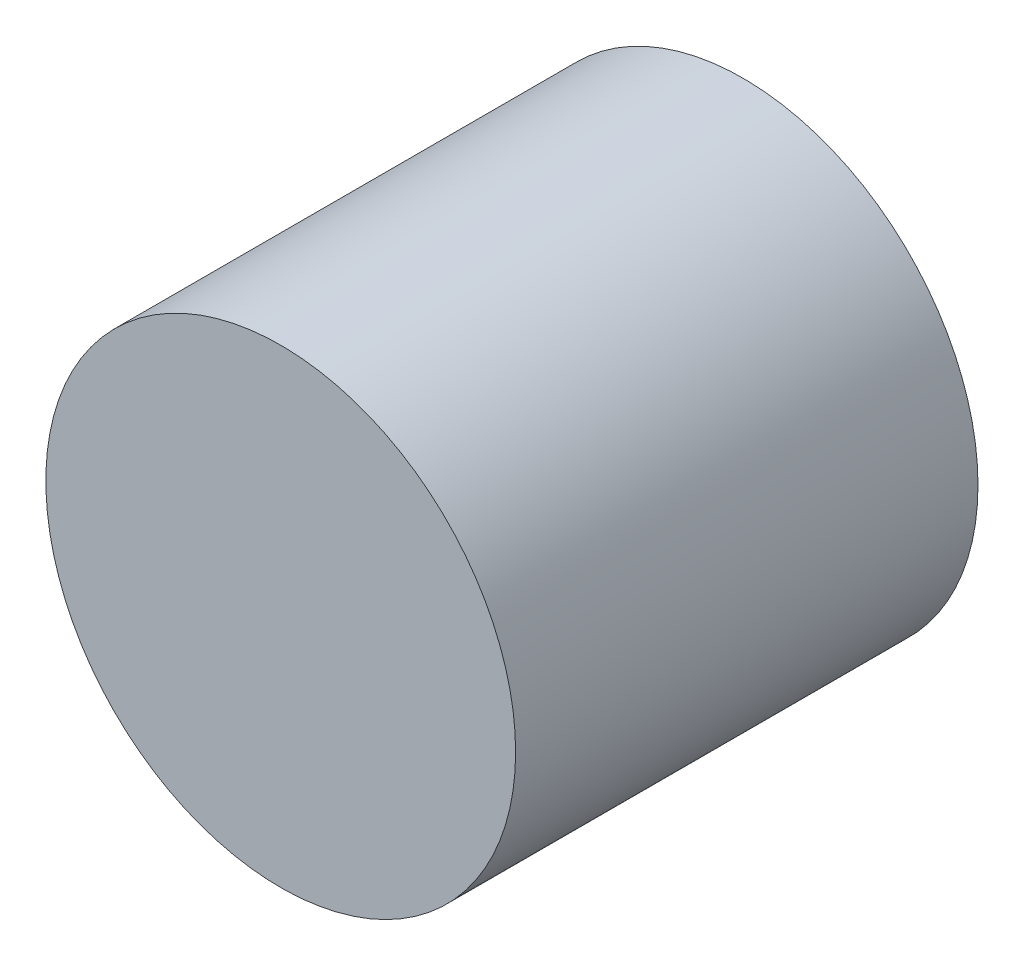
from build123d import *

# Parameters (mm, degrees)
ESBO_O1_R                = 50.8
RESSALTO_EXTRUS_O1_DEPTH = 100
ESBO_O2_R                = 49.8
CORTE_EXTRUS_O1_DEPTH    = 99.6


with BuildPart() as part:
    # Esboço1 → Ressalto-extrusão1 (new body)
    with BuildSketch(Plane.XY):
        Circle(ESBO_O1_R)
    extrude(amount=RESSALTO_EXTRUS_O1_DEPTH)

    # Esboço2 → Corte-extrusão1 (cut)
    with BuildSketch(Plane(origin=(0, 0, 0), x_dir=(-1, 0, 0), z_dir=(0, 0, -1))):
        Circle(ESBO_O2_R)
    extrude(amount=-CORTE_EXTRUS_O1_DEPTH, mode=Mode.SUBTRACT)


solid = part.part
